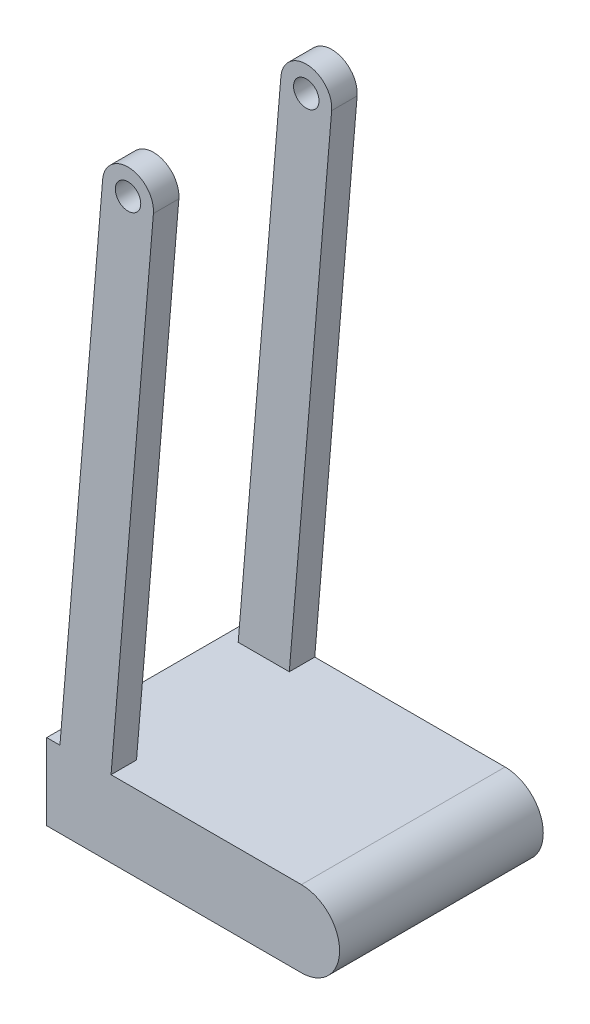
from build123d import *

# Parameters (mm, degrees)
SKETCH_1_R          = 0.5
EXTRUDE_1_DEPTH     = 8
SKETCH_2_W          = 6
SKETCH_2_H          = 21
CUT_EXTRUDE_1_DEPTH = 7


with BuildPart() as part:
    # 草圖1 → 填料-伸長1 (new body)
    with BuildSketch(Plane.XY):
        with BuildLine():
            Line((0.519160932, 3), (2.196426588, 23.083226007))
            ThreePointArc((2.196426588, 23.083226007), (3.276183293, 23.996530698), (4.189487983, 22.916773993))
            Line((4.189487983, 22.916773993), (2.526123692, 3))
            Line((2.526123692, 3), (10, 3))
            ThreePointArc((10, 3), (11.5, 1.5), (10, 0))
            Line((10, 0), (0, 0))
            Line((0, 0), (0, 3))
            Line((0, 3), (0.519160932, 3))
        make_face()
        with Locations((3.192957285, 23)):
            Circle(SKETCH_1_R, mode=Mode.SUBTRACT)
    extrude(amount=EXTRUDE_1_DEPTH)

    # 草圖2 → 除料-伸長1 (cut)
    with BuildSketch(Plane.ZY):
        with Locations((4, 13.5)):
            Rectangle(SKETCH_2_W, SKETCH_2_H)
    extrude(amount=-CUT_EXTRUDE_1_DEPTH, mode=Mode.SUBTRACT)


solid = part.part
